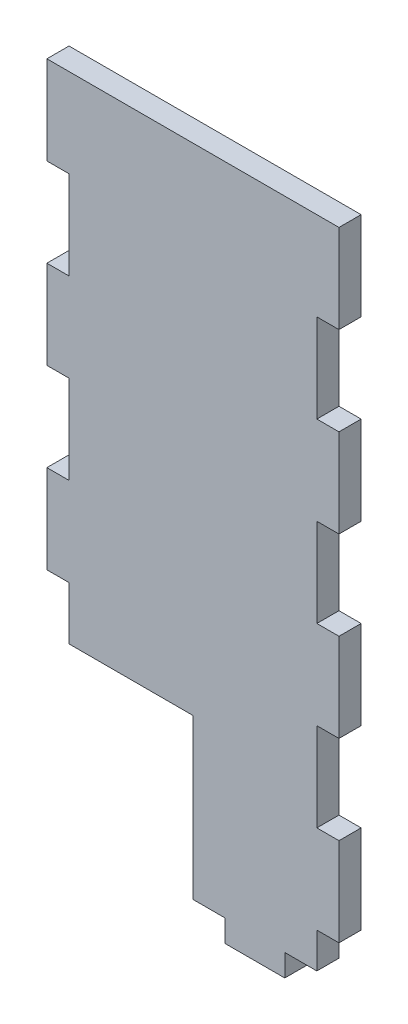
from build123d import *

# Parameters (mm, degrees)
SKETCH1_W           = 71.12
SKETCH1_H           = 142.24
SKETCH1_W_2         = 17.145
SKETCH1_H_2         = 6.35
SKETCH1_W_3         = 6.35
SKETCH1_H_3         = 25.4
BOSS_EXTRUDE1_DEPTH = 6.35


with BuildPart() as part:
    # Sketch1 → Boss-Extrude1 (new body)
    with BuildSketch(Plane.XY):
        Rectangle(SKETCH1_W, SKETCH1_H)
        Polygon((35.56, -81.28), (35.56, -71.12), (0, -71.12), (0, -116.84), (9.2075, -116.84), (26.3525, -116.84), (35.56, -116.84), (35.56, -106.68), align=None)
        with Locations((17.78, -120.015)):
            Rectangle(SKETCH1_W_2, SKETCH1_H_2)
        with Locations((38.735, 58.42)):
            Rectangle(SKETCH1_W_3, SKETCH1_H_3)
        with Locations((38.735, 7.62)):
            Rectangle(SKETCH1_W_3, SKETCH1_H_3)
        with Locations((38.735, -43.18)):
            Rectangle(SKETCH1_W_3, SKETCH1_H_3)
        with Locations((38.735, -93.98)):
            Rectangle(SKETCH1_W_3, SKETCH1_H_3)
        with Locations((-38.735, -43.18)):
            Rectangle(SKETCH1_W_3, SKETCH1_H_3)
        with Locations((-38.735, 7.62)):
            Rectangle(SKETCH1_W_3, SKETCH1_H_3)
        with Locations((-38.735, 58.42)):
            Rectangle(SKETCH1_W_3, SKETCH1_H_3)
    extrude(amount=BOSS_EXTRUDE1_DEPTH)


solid = part.part
